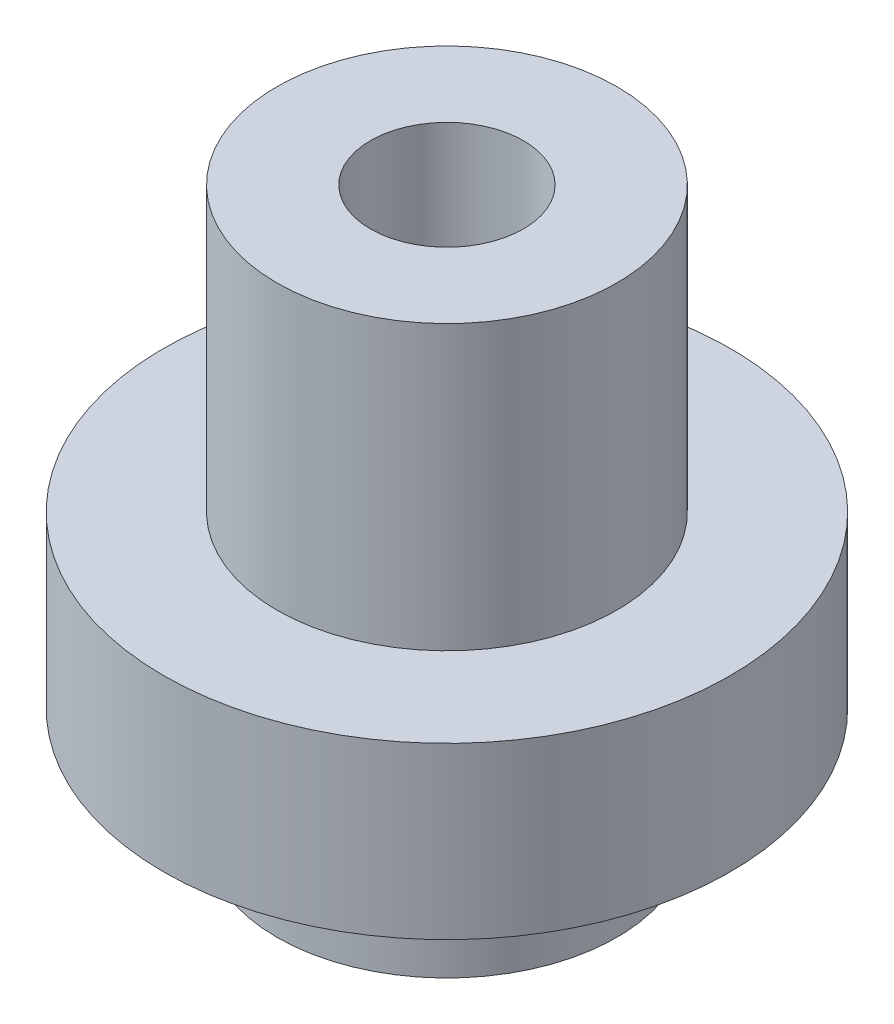
from build123d import *

# Parameters (mm, degrees)
HOLE_WIZARD_2_7_2_7_1_D = 2.7


with BuildPart() as part:
    # 草圖1 → 旋轉1 (revolve)
    with BuildSketch(Plane(origin=(0, 0, 0), x_dir=(0, 0, -1), z_dir=(1, 0, 0)), mode=Mode.PRIVATE) as revolve_1_sk:
        Polygon((0, 0), (3, 0), (3, 2), (5, 2), (5, 5), (3, 5), (3, 10), (0, 10), align=None)
    revolve(revolve_1_sk.sketch.rotate(Axis((0, 10, 0), (0, -1, 0)), 180), axis=Axis((0, 10, 0), (0, -1, 0)))

    # Ø2.7 (2.7) 直徑孔1 (through all)
    with Locations(Plane(origin=(0, 10, 0), x_dir=(1, 0, 0), z_dir=(0, 1, 0))):
        with Locations((0, 0)):
            Hole(HOLE_WIZARD_2_7_2_7_1_D / 2)


solid = part.part
